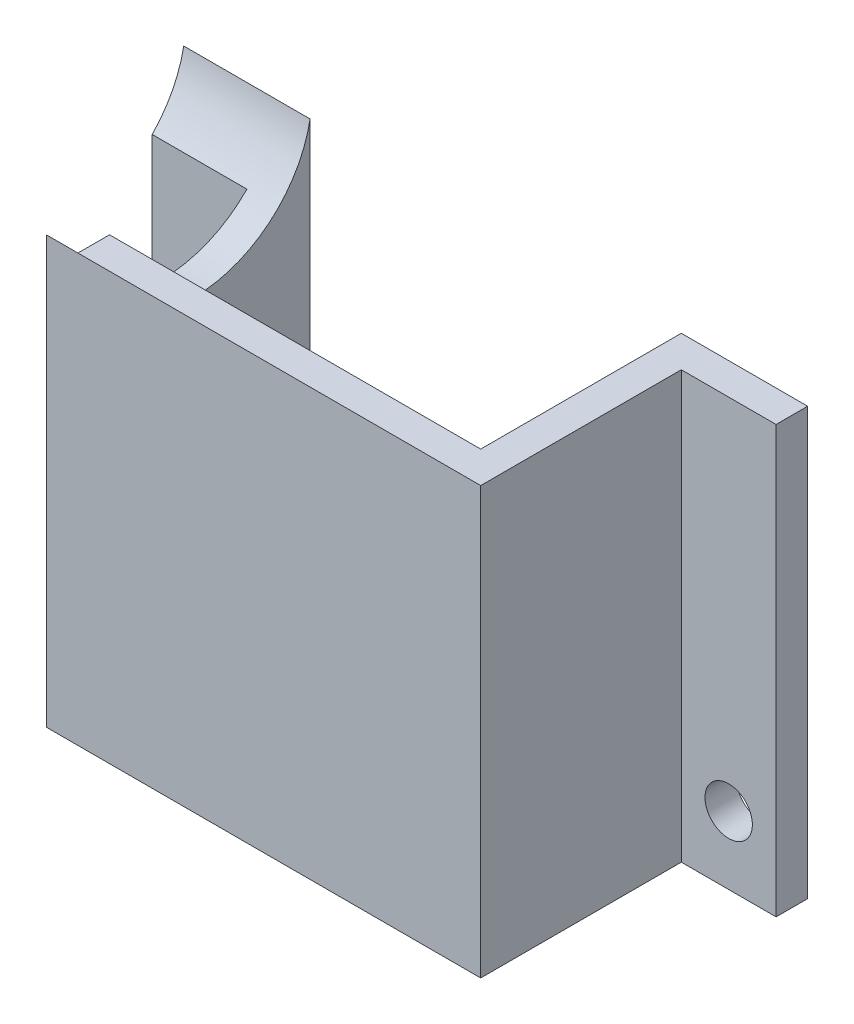
from build123d import *

# Parameters (mm, degrees)
BOSS_EXTRUDE1_DEPTH = 12.7
SKETCH2_W           = 39.5
SKETCH2_H           = 27
BOSS_EXTRUDE2_DEPTH = 2
SKETCH3_W           = 6
SKETCH3_H           = 12.7
CUT_EXTRUDE1_DEPTH  = 38.396997736
CUT_EXTRUDE2_START  = -2
CUT_EXTRUDE2_DEPTH  = 12
SKETCH5_R           = 1.5
CUT_EXTRUDE3_DEPTH  = 33.837341068


with BuildPart() as part:
    # Sketch1 → Boss-Extrude1 (new body)
    with BuildSketch(Plane.XY):
        Polygon((-10.205741627, 6.782296651), (-10.205741627, -6.717703349), (-8.205741627, -6.717703349), (-8.205741627, -12.217703349), (-5.005741627, -12.217703349), (-5.005741627, -6.717703349), (13.294258373, -6.717703349), (13.294258373, 6.782296651), (21.294258373, 6.782296651), (21.294258373, -20.217703349), (-18.205741627, -20.217703349), (-18.205741627, 6.782296651), align=None)
    extrude(amount=BOSS_EXTRUDE1_DEPTH)

    # Sketch2 → Boss-Extrude2 (add)
    with BuildSketch(Plane.XY.offset(12.7)):
        with Locations((1.544258373, -6.717703349)):
            Rectangle(SKETCH2_W, SKETCH2_H)
    extrude(amount=BOSS_EXTRUDE2_DEPTH)

    # Sketch3 → Cut-Extrude1 (cut, through all)
    with BuildSketch(Plane(origin=(0, 6.782296651, 0), x_dir=(1, 0, 0), z_dir=(0, 1, 0))):
        with Locations((-15.205741627, -8.35)):
            Rectangle(SKETCH3_W, SKETCH3_H)
        with Locations((18.294258373, -8.35)):
            Rectangle(SKETCH3_W, SKETCH3_H)
    extrude(amount=-CUT_EXTRUDE1_DEPTH, mode=Mode.SUBTRACT)

    # Sketch4 → Cut-Extrude2 (cut)
    with BuildSketch(Plane.ZY.offset(12.205741627).offset(CUT_EXTRUDE2_START)):
        with BuildLine():
            Line((0, 6.782296651), (14.7, 6.782296651))
            ThreePointArc((14.7, 6.782296651), (7.35, 0.679443812), (0, 6.782296651))
        make_face()
    extrude(amount=CUT_EXTRUDE2_DEPTH, mode=Mode.SUBTRACT)

    # Sketch5 → Cut-Extrude3 (cut, through all)
    with BuildSketch(Plane(origin=(0, 0, 0), x_dir=(-1, 0, 0), z_dir=(0, 0, -1))):
        with Locations((-18.294258373, -15.917381118)):
            Circle(SKETCH5_R)
        with Locations((15.205741627, -15.917381118)):
            Circle(SKETCH5_R)
    extrude(amount=-CUT_EXTRUDE3_DEPTH, mode=Mode.SUBTRACT)


solid = part.part
